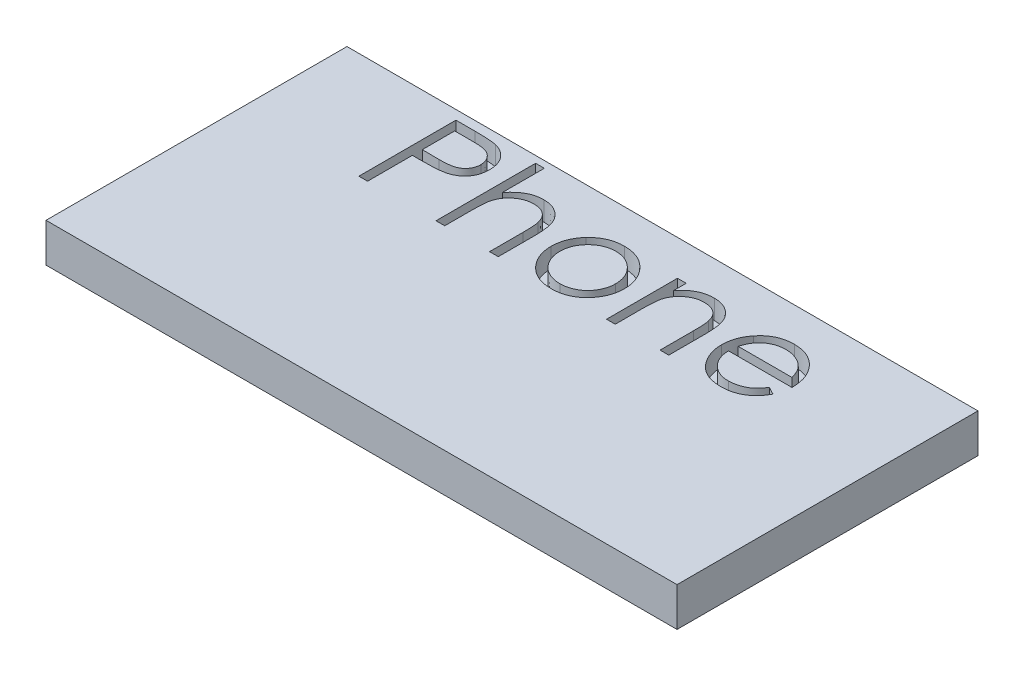
from build123d import *

# Parameters (mm, degrees)
SKETCH1_W           = 165.1
SKETCH1_H           = 78.74
BOSS_EXTRUDE1_DEPTH = 10.16
CUT_EXTRUDE1_DEPTH  = 5.08


with BuildPart() as part:
    # Sketch1 → Boss-Extrude1 (new body)
    with BuildSketch(Plane(origin=(0, 0, 0), x_dir=(1, 0, 0), z_dir=(0, 1, 0))):
        with Locations((82.55, 39.37)):
            Rectangle(SKETCH1_W, SKETCH1_H)
    extrude(amount=BOSS_EXTRUDE1_DEPTH)

    # Sketch2 → Cut-Extrude1 (cut)
    # profile 1 of 5: a face of its own
    with BuildSketch(Plane(origin=(0, 10.16, 0), x_dir=(1, 0, 0), z_dir=(0, 1, 0))):
        with BuildLine():
            Line((30.935897436, 76.314978946), (35.9171875, 76.314978946))
            add(Edge.make_bspline(
                [(35.9171875, 76.314978946), (36.25980379, 76.314602328), (36.916271818, 76.31388071), (37.857632508, 76.292002269), (38.712594561, 76.262779989), (39.479314468, 76.222271393), (40.160151294, 76.174398995), (40.752024268, 76.107255624), (41.25958562, 76.037149479), (41.56370671, 75.965874129), (41.702403846, 75.933368369)],
                knots=[0, 0, 0, 0, 1.415646017, 2.712440637, 3.8905458, 4.950247383, 5.884950622, 6.709939814, 7.411656543, 8, 8, 8, 8], degree=3))
            add(Edge.make_bspline(
                [(41.702403846, 75.933368369), (41.877979777, 75.885311934), (42.224994412, 75.790331451), (42.725019124, 75.600094715), (43.200752746, 75.374527002), (43.653827484, 75.11745041), (44.078675744, 74.817835173), (44.481636156, 74.487826633), (44.859152584, 74.119805535), (45.209102114, 73.717899595), (45.530483217, 73.288855786), (45.807195771, 72.826269317), (46.038896219, 72.337926715), (46.237620532, 71.824167656), (46.380647601, 71.28067788), (46.488393674, 70.711233739), (46.556782285, 70.115896273), (46.563332305, 69.709061806), (46.566666667, 69.501958113)],
                knots=[0, 0, 0, 0, 0.999701418, 1.975846123, 2.934577507, 3.890451536, 4.834027766, 5.787354733, 6.749476667, 7.726910423, 8.712836071, 9.690891519, 10.682875813, 11.679750201, 12.712814741, 13.765529915, 14.8625177, 16, 16, 16, 16], degree=3))
            add(Edge.make_bspline(
                [(46.566666667, 69.501958113), (46.563608327, 69.293113676), (46.557624479, 68.884495429), (46.485805723, 68.286704337), (46.389066618, 67.715433735), (46.240316581, 67.171950294), (46.045493697, 66.65948156), (45.81695137, 66.170196048), (45.541299464, 65.712417857), (45.2245627, 65.284485061), (44.872216843, 64.885995983), (44.485752664, 64.519838332), (44.06673037, 64.188155419), (43.616481638, 63.890203668), (43.130617021, 63.632892382), (42.616505392, 63.402425083), (42.069678107, 63.208869386), (41.691272434, 63.107051226), (41.498878205, 63.055283434)],
                knots=[0, 0, 0, 0, 1.121902311, 2.195077645, 3.232258892, 4.234102512, 5.217864754, 6.176164875, 7.132989551, 8.084763148, 9.034132444, 9.988522005, 10.94243251, 11.903244335, 12.886203696, 13.894208494, 14.929344452, 16, 16, 16, 16], degree=3))
            add(Edge.make_bspline(
                [(41.498878205, 63.055283434), (41.33974841, 63.021443514), (40.991006211, 62.947281362), (40.41665617, 62.864488561), (39.747943941, 62.793821402), (38.985782253, 62.740836003), (38.130855228, 62.695476186), (37.182700389, 62.659422019), (36.139456515, 62.63961108), (35.411773772, 62.638589326), (35.031850962, 62.638055869)],
                knots=[0, 0, 0, 0, 0.601384939, 1.31797006, 2.144135048, 3.087295005, 4.142315834, 5.309527816, 6.595305764, 8, 8, 8, 8], degree=3))
            Line((35.031850962, 62.638055869), (33.215384615, 62.638055869))
            Line((33.215384615, 62.638055869), (33.215384615, 50.914978946))
            Line((33.215384615, 50.914978946), (30.935897436, 50.914978946))
            Line((30.935897436, 50.914978946), (30.935897436, 76.314978946))
        make_face()
        with BuildLine():
            Line((33.215384615, 73.709850741), (33.215384615, 65.243184075))
            Line((33.215384615, 65.243184075), (37.662419872, 65.187214523))
            add(Edge.make_bspline(
                [(37.662419872, 65.187214523), (37.879553048, 65.187102302), (38.298724167, 65.186885661), (38.904232759, 65.215806997), (39.466003015, 65.249193719), (39.982309362, 65.298077278), (40.453384544, 65.367174404), (40.880014039, 65.436928159), (41.258889749, 65.537841362), (41.702295385, 65.673717349), (42.196385964, 65.905456903), (42.733904744, 66.241824677), (43.189439857, 66.670581816), (43.583635496, 67.152658078), (43.89646101, 67.688954617), (44.125467355, 68.262769186), (44.260023182, 68.868217009), (44.278065845, 69.282513788), (44.287179487, 69.491781831)],
                knots=[0, 0, 0, 0, 1.160613943, 2.240541288, 3.23993089, 4.169200891, 5.011653406, 5.7853311, 6.478053781, 7.106038997, 8.262395093, 9.384106736, 10.481365981, 11.59014053, 12.70357646, 13.786202915, 14.881775077, 16, 16, 16, 16], degree=3))
            add(Edge.make_bspline(
                [(44.287179487, 69.491781831), (44.278016281, 69.695987043), (44.259800962, 70.101921731), (44.124412698, 70.696853308), (43.896906248, 71.264620991), (43.581535534, 71.794197096), (43.198785619, 72.274538702), (42.753927529, 72.691803567), (42.248008433, 73.027241067), (41.777395556, 73.243745453), (41.359375521, 73.375936309), (40.99628644, 73.468427437), (40.586325545, 73.542273266), (40.129359374, 73.602068514), (39.62892978, 73.65325649), (39.080737437, 73.687989011), (38.486858998, 73.708319579), (38.074576569, 73.709327997), (37.860857372, 73.709850741)],
                knots=[0, 0, 0, 0, 1.120700087, 2.227813068, 3.331159281, 4.466773991, 5.599788987, 6.693661531, 7.80175334, 8.91857717, 9.525282508, 10.207424825, 10.974604443, 11.810962634, 12.737642355, 13.736264703, 14.826523623, 16, 16, 16, 16], degree=3))
            Line((37.860857372, 73.709850741), (33.215384615, 73.709850741))
        make_face(mode=Mode.SUBTRACT)
    # profile 2 of 5: a face of its own
    with BuildSketch(Plane(origin=(0, 10.16, 0), x_dir=(1, 0, 0), z_dir=(0, 1, 0))):
        with BuildLine():
            Line((51.125641026, 76.966260998), (53.405128205, 76.966260998))
            Line((53.405128205, 76.966260998), (53.405128205, 65.970788241))
            add(Edge.make_bspline(
                [(53.405128205, 65.970788241), (53.64981948, 66.27663314), (54.12624593, 66.87212883), (54.928132034, 67.649087186), (55.751606363, 68.322540037), (56.625110983, 68.858628498), (57.532620473, 69.282130269), (58.47796235, 69.582486332), (59.461312256, 69.767188577), (60.129151916, 69.790399952), (60.467467949, 69.802158434)],
                knots=[0, 0, 0, 0, 1.125788106, 2.19196713, 3.20547328, 4.180437432, 5.132270164, 6.079753143, 7.027236121, 8, 8, 8, 8], degree=3))
            add(Edge.make_bspline(
                [(60.467467949, 69.802158434), (60.810951371, 69.789491597), (61.483231281, 69.764699542), (62.462085325, 69.568659577), (63.376201388, 69.233688454), (64.222862076, 68.77527633), (64.983589878, 68.204336384), (65.657413881, 67.545159048), (66.207801392, 66.781171185), (66.582263555, 66.075368656), (66.825910572, 65.447344556), (66.980138112, 64.908599581), (67.110906009, 64.308274839), (67.224841234, 63.646679353), (67.30077694, 62.920637253), (67.361770454, 62.133424092), (67.405142436, 61.285085006), (67.406823223, 60.697835196), (67.407692308, 60.394185677)],
                knots=[0, 0, 0, 0, 1.235656852, 2.418478516, 3.575258207, 4.727955599, 5.870717718, 6.98870536, 8.107142894, 9.245821548, 9.854588956, 10.528768408, 11.260415777, 12.065282286, 12.943670737, 13.886611085, 14.907229059, 16, 16, 16, 16], degree=3))
            Line((67.407692308, 60.394185677), (67.407692308, 50.914978946))
            Line((67.407692308, 50.914978946), (65.128205128, 50.914978946))
            Line((65.128205128, 50.914978946), (65.128205128, 59.646228946))
            add(Edge.make_bspline(
                [(65.128205128, 59.646228946), (65.126824071, 59.898942034), (65.124182343, 60.382339161), (65.1154495, 61.074424633), (65.095955252, 61.702139439), (65.064453258, 62.263471831), (65.031322171, 62.759204381), (64.98572324, 63.188617176), (64.932671827, 63.552300003), (64.885001242, 63.771209022), (64.863621795, 63.869385998)],
                knots=[0, 0, 0, 0, 1.430932559, 2.737130458, 3.918967929, 4.986496826, 5.920444988, 6.731744033, 7.431208747, 8, 8, 8, 8], degree=3))
            add(Edge.make_bspline(
                [(64.863621795, 63.869385998), (64.780714416, 64.15745294), (64.621325464, 64.711259958), (64.250863, 65.463552877), (63.788154749, 66.104973566), (63.22320605, 66.626865829), (62.566011065, 67.036252429), (61.812284469, 67.319772905), (60.969120086, 67.495742088), (60.375112262, 67.513444462), (60.065504808, 67.522671254)],
                knots=[0, 0, 0, 0, 1.090059168, 2.095632401, 3.037101401, 3.955032261, 4.878929692, 5.839099886, 6.873700383, 8, 8, 8, 8], degree=3))
            add(Edge.make_bspline(
                [(60.065504808, 67.522671254), (59.882132968, 67.519218114), (59.519244835, 67.512384441), (58.981137375, 67.443776148), (58.459137885, 67.33166259), (57.948219223, 67.179955367), (57.459209731, 66.973522045), (56.977855601, 66.734542957), (56.517794771, 66.442020192), (56.0708577, 66.113810337), (55.654896172, 65.750446938), (55.267893677, 65.366929036), (54.922901151, 64.958533581), (54.610346234, 64.531812738), (54.340538104, 64.080913437), (54.105021451, 63.610183812), (53.905190968, 63.119004813), (53.805893716, 62.778100079), (53.756209936, 62.607527023)],
                knots=[0, 0, 0, 0, 1.024319606, 2.027102035, 3.025350316, 4.005802111, 5.00026367, 5.987881639, 7.005602596, 8.042517216, 9.083927026, 10.089214625, 11.084353441, 12.06828073, 13.041928858, 14.016821737, 15.00770877, 16, 16, 16, 16], degree=3))
            add(Edge.make_bspline(
                [(53.756209936, 62.607527023), (53.72762095, 62.484003551), (53.66532203, 62.214830701), (53.597722954, 61.770879893), (53.537214373, 61.254995936), (53.48606204, 60.667961294), (53.454688785, 60.00762485), (53.420883266, 59.278492747), (53.408299279, 58.475997739), (53.406216821, 57.917956056), (53.405128205, 57.626236959)],
                knots=[0, 0, 0, 0, 0.607992626, 1.324890765, 2.152360218, 3.099583803, 4.150613268, 5.323148443, 6.60066238, 8, 8, 8, 8], degree=3))
            Line((53.405128205, 57.626236959), (53.405128205, 50.914978946))
            Line((53.405128205, 50.914978946), (51.125641026, 50.914978946))
            Line((51.125641026, 50.914978946), (51.125641026, 76.966260998))
        make_face()
    # profile 3 of 5: a face of its own
    with BuildSketch(Plane(origin=(0, 10.16, 0), x_dir=(1, 0, 0), z_dir=(0, 1, 0))):
        with BuildLine():
            add(Edge.make_bspline(
                [(81.583253205, 69.802158434), (81.931532728, 69.794742424), (82.614423757, 69.78020144), (83.614515272, 69.624789975), (84.569157116, 69.387137674), (85.482005482, 69.05859548), (86.341369454, 68.618217897), (87.159766483, 68.092733327), (87.934952776, 67.47019679), (88.399577045, 66.988626809), (88.635416667, 66.744185677)],
                knots=[0, 0, 0, 0, 1.054011418, 2.066658804, 3.057071809, 4.030435133, 4.997543892, 5.974964718, 6.972108034, 8, 8, 8, 8], degree=3))
            add(Edge.make_bspline(
                [(88.635416667, 66.744185677), (88.838485705, 66.51040418), (89.240693836, 66.047365502), (89.756427909, 65.29657334), (90.200721517, 64.519042324), (90.556778434, 63.704447439), (90.837521177, 62.859899826), (91.036843659, 61.982496659), (91.155403129, 61.074175625), (91.171390375, 60.457290629), (91.179487179, 60.144866767)],
                knots=[0, 0, 0, 0, 1.025258237, 2.030674902, 3.01204498, 3.988269485, 4.97094183, 5.956517959, 6.965070386, 8, 8, 8, 8], degree=3))
            add(Edge.make_bspline(
                [(91.179487179, 60.144866767), (91.172365474, 59.830632063), (91.158292653, 59.209689632), (91.025170408, 58.295149092), (90.818116242, 57.408363807), (90.521793759, 56.55304643), (90.141823481, 55.726582482), (89.678159634, 54.932581753), (89.12754847, 54.1694777), (88.503405179, 53.443750074), (87.813600135, 52.774886687), (87.065271516, 52.191932959), (86.273125099, 51.692485325), (85.426627621, 51.290175337), (84.533509288, 50.972967798), (83.591843708, 50.750173393), (82.603093769, 50.615468602), (81.927981934, 50.598170671), (81.583253205, 50.589337921)],
                knots=[0, 0, 0, 0, 0.998656419, 1.973391657, 2.932242238, 3.890759089, 4.846373663, 5.82037756, 6.809684879, 7.83454468, 8.860553229, 9.859544525, 10.845671541, 11.83227036, 12.833544569, 13.85385346, 14.904124723, 16, 16, 16, 16], degree=3))
            add(Edge.make_bspline(
                [(81.583253205, 50.589337921), (81.236835526, 50.598200316), (80.558359002, 50.615557765), (79.566119018, 50.749650046), (78.622765784, 50.972865119), (77.72847824, 51.291217781), (76.878341351, 51.692498184), (76.081605059, 52.190423017), (75.332668529, 52.775059572), (74.642717557, 53.443703229), (74.018613392, 54.16948977), (73.467992132, 54.93257862), (73.004330907, 55.726583299), (72.624359942, 56.553046212), (72.328037643, 57.408363866), (72.120983427, 58.295149076), (71.987861196, 59.209689636), (71.973788373, 59.830632064), (71.966666667, 60.144866767)],
                knots=[0, 0, 0, 0, 1.099876186, 2.154163076, 3.173186993, 4.173200201, 5.163417411, 6.152872554, 7.150605724, 8.17532212, 9.198891216, 10.186952605, 11.159729845, 12.11414092, 13.071450619, 14.029093627, 15.002601286, 16, 16, 16, 16], degree=3))
            add(Edge.make_bspline(
                [(71.966666667, 60.144866767), (71.97481869, 60.455592557), (71.990958296, 61.07077622), (72.109398562, 61.977389746), (72.307943515, 62.853307941), (72.589022792, 63.694595681), (72.948361606, 64.505620845), (73.386412096, 65.285073047), (73.907406972, 66.032470228), (74.30801542, 66.494910466), (74.510737179, 66.728921254)],
                knots=[0, 0, 0, 0, 1.031353054, 2.041901799, 3.029428768, 4.008703097, 4.981709435, 5.96992636, 6.972712378, 8, 8, 8, 8], degree=3))
            add(Edge.make_bspline(
                [(74.510737179, 66.728921254), (74.74622124, 66.975482242), (75.209342081, 67.460387809), (75.988387133, 68.081109555), (76.804770864, 68.617529062), (77.673631756, 69.049156454), (78.585730211, 69.389070269), (79.545264142, 69.625402864), (80.548749312, 69.779641497), (81.234981991, 69.794577988), (81.583253205, 69.802158434)],
                knots=[0, 0, 0, 0, 1.027980169, 2.021703884, 2.998553061, 3.971491411, 4.943284454, 5.930300938, 6.949603206, 8, 8, 8, 8], degree=3))
        make_face()
        with BuildLine():
            add(Edge.make_bspline(
                [(81.573076923, 67.522671254), (81.326786829, 67.515671074), (80.840564581, 67.501851424), (80.124868167, 67.396739658), (79.435873907, 67.230206343), (78.772274638, 66.993594049), (78.136308187, 66.688076325), (77.527365666, 66.312821369), (76.94365596, 65.872799342), (76.396597557, 65.36869881), (75.894531634, 64.818034107), (75.455634318, 64.231306017), (75.082434975, 63.61803139), (74.771537822, 62.977572486), (74.539982799, 62.303438968), (74.371812865, 61.603265244), (74.266800263, 60.875624793), (74.253110544, 60.380970546), (74.246153846, 60.129602344)],
                knots=[0, 0, 0, 0, 1.021534396, 2.016698045, 2.994645724, 3.958388632, 4.93408049, 5.916473867, 6.921342795, 7.962252576, 8.998418191, 10.008913653, 10.997312074, 11.973003931, 12.956656626, 13.948281152, 14.957379055, 16, 16, 16, 16], degree=3))
            add(Edge.make_bspline(
                [(74.246153846, 60.129602344), (74.257814795, 59.80483049), (74.280959597, 59.16021909), (74.469175313, 58.210904085), (74.784035744, 57.299538644), (75.209212003, 56.431465443), (75.741931418, 55.628300911), (76.369580417, 54.912227853), (77.085422813, 54.29402225), (77.880925415, 53.781081256), (78.739839608, 53.373521886), (79.648842624, 53.084695034), (80.596920803, 52.896940466), (81.244843824, 52.878278909), (81.573076923, 52.8688251)],
                knots=[0, 0, 0, 0, 1.016792936, 2.018143844, 3.017858371, 4.030088057, 5.03801393, 6.028138512, 7.003788237, 7.991172063, 8.984598303, 9.972568034, 10.972917682, 12, 12, 12, 12], degree=3))
            add(Edge.make_bspline(
                [(81.573076923, 52.8688251), (81.901291143, 52.878333991), (82.549176897, 52.897104278), (83.49593778, 53.083749427), (84.402456319, 53.374787422), (85.260478388, 53.780622888), (86.055618882, 54.295970126), (86.776609648, 54.908736977), (87.398899569, 55.630197498), (87.931092016, 56.432529279), (88.363231234, 57.298192863), (88.676617899, 58.21107229), (88.865286094, 59.160176252), (88.888369822, 59.804816138), (88.9, 60.129602344)],
                knots=[0, 0, 0, 0, 1.02726834, 2.027799167, 3.010890988, 4.004497153, 4.992059811, 5.971914811, 6.958719428, 7.966827853, 8.981595046, 9.981490638, 10.983022906, 12, 12, 12, 12], degree=3))
            add(Edge.make_bspline(
                [(88.9, 60.129602344), (88.893045698, 60.380972048), (88.879360692, 60.875629252), (88.774313808, 61.603248201), (88.606270748, 62.303501502), (88.374248155, 62.977341754), (88.064701883, 63.619689643), (87.684305727, 64.229505376), (87.247200571, 64.820066596), (86.739076322, 65.366918732), (86.192588952, 65.872995855), (85.608642674, 66.312991995), (85.000603116, 66.686427117), (84.366484259, 66.996207262), (83.702799911, 67.228053675), (83.01477103, 67.397701229), (82.302128238, 67.501407228), (81.817648325, 67.515537912), (81.573076923, 67.522671254)],
                knots=[0, 0, 0, 0, 1.042956736, 2.052379634, 3.044323526, 4.02829302, 5.004299113, 5.996692471, 7.007513377, 8.048758398, 9.090003419, 10.095195979, 11.07790575, 12.047570684, 13.018257071, 13.989683339, 14.985167495, 16, 16, 16, 16], degree=3))
        make_face(mode=Mode.SUBTRACT)
    # profile 4 of 5: a face of its own
    with BuildSketch(Plane(origin=(0, 10.16, 0), x_dir=(1, 0, 0), z_dir=(0, 1, 0))):
        with BuildLine():
            Line((95.738461538, 69.476517408), (98.017948718, 69.476517408))
            Line((98.017948718, 69.476517408), (98.017948718, 66.128520613))
            add(Edge.make_bspline(
                [(98.017948718, 66.128520613), (98.261336127, 66.43217923), (98.733637886, 67.021439371), (99.520198476, 67.795925826), (100.351459924, 68.434156888), (101.222331607, 68.942910136), (102.133995737, 69.326425651), (103.080895182, 69.603401265), (104.068699049, 69.769479735), (104.740452391, 69.791180264), (105.080288462, 69.802158434)],
                knots=[0, 0, 0, 0, 1.12780773, 2.188550248, 3.19190651, 4.159438251, 5.104880172, 6.052711206, 7.014878035, 8, 8, 8, 8], degree=3))
            add(Edge.make_bspline(
                [(105.080288462, 69.802158434), (105.423773635, 69.789493301), (106.096056972, 69.764704581), (107.074886332, 69.568640594), (107.989093246, 69.233757886), (108.835418023, 68.775018861), (109.598341228, 68.204560454), (110.268355865, 67.539967409), (110.82253486, 66.775528405), (111.194081437, 66.0663375), (111.43883328, 65.437224535), (111.592919387, 64.898405263), (111.723772795, 64.298107823), (111.837214624, 63.638146234), (111.913974235, 62.913896511), (111.974515437, 62.128327545), (112.017903675, 61.281693798), (112.01962512, 60.696139417), (112.020512821, 60.394185677)],
                knots=[0, 0, 0, 0, 1.235846778, 2.418850247, 3.575807741, 4.728682307, 5.871620074, 6.994088408, 8.11269785, 9.256955736, 9.865816715, 10.540099792, 11.271859618, 12.076849838, 12.949306005, 13.892391288, 14.913166135, 16, 16, 16, 16], degree=3))
            Line((112.020512821, 60.394185677), (112.020512821, 50.914978946))
            Line((112.020512821, 50.914978946), (109.741025641, 50.914978946))
            Line((109.741025641, 50.914978946), (109.741025641, 59.646228946))
            add(Edge.make_bspline(
                [(109.741025641, 59.646228946), (109.739623503, 59.898940404), (109.736941451, 60.382334413), (109.728482187, 61.074441039), (109.708091019, 61.702086494), (109.679437548, 62.263770246), (109.637498298, 62.758952945), (109.593791202, 63.188643125), (109.540342513, 63.552295233), (109.492714515, 63.771207545), (109.471354167, 63.869385998)],
                knots=[0, 0, 0, 0, 1.430800155, 2.736877192, 3.918605307, 4.986035426, 5.920637409, 6.731861385, 7.431261377, 8, 8, 8, 8], degree=3))
            add(Edge.make_bspline(
                [(109.471354167, 63.869385998), (109.394243167, 64.15757574), (109.245828349, 64.712251829), (108.879096014, 65.464631417), (108.415987388, 66.104698266), (107.850671567, 66.628495046), (107.188609132, 67.036134832), (106.431637296, 67.318974389), (105.587060875, 67.495876457), (104.993031927, 67.513490501), (104.683413462, 67.522671254)],
                knots=[0, 0, 0, 0, 1.084156227, 2.086665306, 3.027808233, 3.945421172, 4.874247719, 5.839848303, 6.874090471, 8, 8, 8, 8], degree=3))
            add(Edge.make_bspline(
                [(104.683413462, 67.522671254), (104.500042272, 67.51921682), (104.137155426, 67.512380585), (103.599038487, 67.443791165), (103.077074487, 67.331606944), (102.56602497, 67.180160261), (102.076111267, 66.972154078), (101.591593268, 66.736083792), (101.130715609, 66.441819625), (100.683650955, 66.113864829), (100.267723723, 65.750432868), (99.880712352, 65.366932709), (99.535722148, 64.958532613), (99.223166619, 64.531812994), (98.953358651, 64.080913369), (98.717841954, 63.610183831), (98.518011484, 63.119004808), (98.41871423, 62.778100078), (98.369030449, 62.607527023)],
                knots=[0, 0, 0, 0, 1.023777757, 2.026029729, 3.023749952, 4.003683103, 4.997618607, 5.993177895, 7.010360494, 8.046726602, 9.087585522, 10.09234134, 11.086953743, 12.070360549, 13.043493632, 14.017870808, 15.008233677, 16, 16, 16, 16], degree=3))
            add(Edge.make_bspline(
                [(98.369030449, 62.607527023), (98.340439856, 62.48230355), (98.278199632, 62.209698598), (98.210975412, 61.76233624), (98.149960437, 61.244829565), (98.098892223, 60.657782464), (98.0676472, 59.999139599), (98.033579292, 59.271713804), (98.021176392, 58.472604489), (98.019054737, 57.916259633), (98.017948718, 57.626236959)],
                knots=[0, 0, 0, 0, 0.615963638, 1.340920617, 2.168419149, 3.115676021, 4.16674242, 5.331190069, 6.6087489, 8, 8, 8, 8], degree=3))
            Line((98.017948718, 57.626236959), (98.017948718, 50.914978946))
            Line((98.017948718, 50.914978946), (95.738461538, 50.914978946))
            Line((95.738461538, 50.914978946), (95.738461538, 69.476517408))
        make_face()
    # profile 5 of 5: a face of its own
    with BuildSketch(Plane(origin=(0, 10.16, 0), x_dir=(1, 0, 0), z_dir=(0, 1, 0))):
        with BuildLine():
            Line((132.464663462, 56.776517408), (134.48974359, 55.713095934))
            add(Edge.make_bspline(
                [(134.48974359, 55.713095934), (134.328369441, 55.426850044), (134.014399254, 54.869928898), (133.474462398, 54.104794824), (132.908462786, 53.416471401), (132.290851132, 52.823347624), (131.640105462, 52.306266145), (130.952617053, 51.853871645), (130.224806776, 51.468382955), (129.456640202, 51.143607467), (128.641666316, 50.893892852), (127.777910168, 50.717513649), (126.863717031, 50.608487642), (126.237090468, 50.595822906), (125.916225962, 50.589337921)],
                knots=[0, 0, 0, 0, 1.120438281, 2.179929193, 3.190490725, 4.156257408, 5.095198341, 6.022838206, 6.959905092, 7.901321166, 8.864066838, 9.862729781, 10.905609505, 12, 12, 12, 12], degree=3))
            add(Edge.make_bspline(
                [(125.916225962, 50.589337921), (125.55959561, 50.597663136), (124.863913111, 50.613903219), (123.851253232, 50.75391139), (122.897814025, 50.982310793), (122.003649092, 51.301375008), (121.170948173, 51.718133303), (120.398056255, 52.225839257), (119.680908839, 52.821884762), (119.042104578, 53.511432666), (118.467020401, 54.249353156), (117.959558736, 55.018290147), (117.535324807, 55.816308976), (117.190228722, 56.63832935), (116.91151913, 57.479170177), (116.717269337, 58.346481971), (116.605293452, 59.237917353), (116.588134333, 59.84096659), (116.579487179, 60.144866767)],
                knots=[0, 0, 0, 0, 1.145258523, 2.234067595, 3.276747158, 4.290159414, 5.277019952, 6.260822364, 7.254936242, 8.264827045, 9.274100331, 10.257902744, 11.220704747, 12.172965371, 13.118907548, 14.062713208, 15.023725156, 16, 16, 16, 16], degree=3))
            add(Edge.make_bspline(
                [(116.579487179, 60.144866767), (116.587173519, 60.430034965), (116.60240683, 60.995200674), (116.698424544, 61.831699197), (116.868592157, 62.644705681), (117.102100336, 63.434895675), (117.403643666, 64.200946133), (117.772540342, 64.943323281), (118.209365027, 65.661237153), (118.546623859, 66.114105609), (118.71650641, 66.342222536)],
                knots=[0, 0, 0, 0, 1.024358464, 2.0301432, 3.019427413, 4.004406732, 4.986367066, 5.972626655, 6.978780325, 8, 8, 8, 8], degree=3))
            add(Edge.make_bspline(
                [(118.71650641, 66.342222536), (118.946613594, 66.617042336), (119.399538749, 67.157976342), (120.165576299, 67.868728764), (120.995069153, 68.464132161), (121.877622097, 68.957669663), (122.823492508, 69.332672701), (123.819965649, 69.612127726), (124.878387903, 69.768722435), (125.601962935, 69.790840999), (125.972195513, 69.802158434)],
                knots=[0, 0, 0, 0, 1.030682036, 2.02871468, 2.997146059, 3.962720338, 4.930598197, 5.918074684, 6.934738563, 8, 8, 8, 8], degree=3))
            add(Edge.make_bspline(
                [(125.972195513, 69.802158434), (126.352815277, 69.792331907), (127.09950449, 69.773054503), (128.188309026, 69.594337683), (129.218538226, 69.310927716), (130.189779829, 68.910668779), (131.102132304, 68.394253746), (131.949665349, 67.754595811), (132.746873469, 67.011333121), (133.210667155, 66.439737258), (133.446674679, 66.148873177)],
                knots=[0, 0, 0, 0, 1.056321875, 2.072262726, 3.055038591, 4.01806755, 4.982017516, 5.957941055, 6.960871419, 8, 8, 8, 8], degree=3))
            add(Edge.make_bspline(
                [(133.446674679, 66.148873177), (133.607253032, 65.929681472), (133.927340879, 65.492757068), (134.328276976, 64.780314956), (134.676310643, 64.0349295), (134.954498417, 63.244551916), (135.179756511, 62.418546963), (135.342728853, 61.551009638), (135.438302656, 60.642198281), (135.457089203, 60.022971279), (135.466666667, 59.707286639)],
                knots=[0, 0, 0, 0, 0.94817472, 1.890038105, 2.849395472, 3.817997239, 4.812318967, 5.836947057, 6.897266129, 8, 8, 8, 8], degree=3))
            Line((135.466666667, 59.707286639), (118.858974359, 59.707286639))
            add(Edge.make_bspline(
                [(118.858974359, 59.707286639), (118.870147503, 59.462717555), (118.892119039, 58.981782317), (118.99455465, 58.278051491), (119.15601718, 57.607684951), (119.382941234, 56.975710875), (119.65774634, 56.373875092), (119.994374113, 55.806642024), (120.395981162, 55.276595331), (120.84393338, 54.778993819), (121.342550586, 54.335867152), (121.867116809, 53.939251404), (122.425144395, 53.606833645), (123.012233344, 53.337013874), (123.627434299, 53.12578518), (124.270941086, 52.981601567), (124.941487416, 52.885029992), (125.398583886, 52.87429185), (125.631290064, 52.8688251)],
                knots=[0, 0, 0, 0, 1.094153842, 2.151609401, 3.174256925, 4.172055639, 5.149267565, 6.128595816, 7.11444997, 8.118368179, 9.117203808, 10.09244225, 11.054858984, 12.015122123, 12.976791628, 13.957293641, 14.960065497, 16, 16, 16, 16], degree=3))
            add(Edge.make_bspline(
                [(125.631290064, 52.8688251), (125.858809821, 52.873237854), (126.310252664, 52.881993605), (126.9825606, 52.967133758), (127.64397317, 53.104803758), (128.291752877, 53.292691115), (128.912752731, 53.521848842), (129.487849008, 53.798366723), (130.016751144, 54.104253457), (130.511085702, 54.454117955), (130.990572339, 54.882348798), (131.466223526, 55.416733745), (131.976231239, 56.048740375), (132.295469998, 56.524414637), (132.464663462, 56.776517408)],
                knots=[0, 0, 0, 0, 0.99110716, 1.966546729, 2.947904876, 3.932708344, 4.903319531, 5.828989031, 6.710028674, 7.56322171, 8.463672341, 9.504779593, 10.677557249, 12, 12, 12, 12], degree=3))
        make_face()
        with BuildLine():
            add(Edge.make_bspline(
                [(133.187179487, 61.986773818), (133.10374684, 62.289127245), (132.943165853, 62.871060263), (132.607621951, 63.676899867), (132.229731341, 64.393092063), (131.782533633, 65.014155686), (131.275849167, 65.565724037), (130.690595556, 66.047733198), (130.034289358, 66.478934129), (129.310323022, 66.842897982), (128.543665496, 67.152704386), (127.74098056, 67.36044094), (126.921955471, 67.50275019), (126.36798665, 67.516002519), (126.089222756, 67.522671254)],
                knots=[0, 0, 0, 0, 1.154881502, 2.222775134, 3.210006277, 4.132804581, 5.035138423, 5.962687519, 6.919655026, 7.923214229, 8.944639381, 9.960483929, 10.97369054, 12, 12, 12, 12], degree=3))
            add(Edge.make_bspline(
                [(126.089222756, 67.522671254), (125.861715403, 67.518232266), (125.411981195, 67.509457321), (124.7493963, 67.426216954), (124.1130922, 67.288622651), (123.498373827, 67.100191251), (122.913296668, 66.849031679), (122.345826064, 66.554513406), (121.810391188, 66.194983055), (121.475537215, 65.920961651), (121.306370192, 65.782527023)],
                knots=[0, 0, 0, 0, 1.04873581, 2.073130211, 3.073294108, 4.04793562, 5.032784715, 6.005352987, 6.992311501, 8, 8, 8, 8], degree=3))
            add(Edge.make_bspline(
                [(121.306370192, 65.782527023), (121.18522466, 65.672985418), (120.940055629, 65.451299908), (120.612464416, 65.069362237), (120.298807271, 64.657508043), (120.013357334, 64.199980568), (119.751537135, 63.701989771), (119.506536158, 63.167736076), (119.286017625, 62.593165359), (119.161948712, 62.192771086), (119.098116987, 61.986773818)],
                knots=[0, 0, 0, 0, 0.879870761, 1.780643979, 2.707998968, 3.669668524, 4.684282772, 5.740141944, 6.837334558, 8, 8, 8, 8], degree=3))
            Line((119.098116987, 61.986773818), (133.187179487, 61.986773818))
        make_face(mode=Mode.SUBTRACT)
    extrude(amount=-CUT_EXTRUDE1_DEPTH, mode=Mode.SUBTRACT)


solid = part.part
